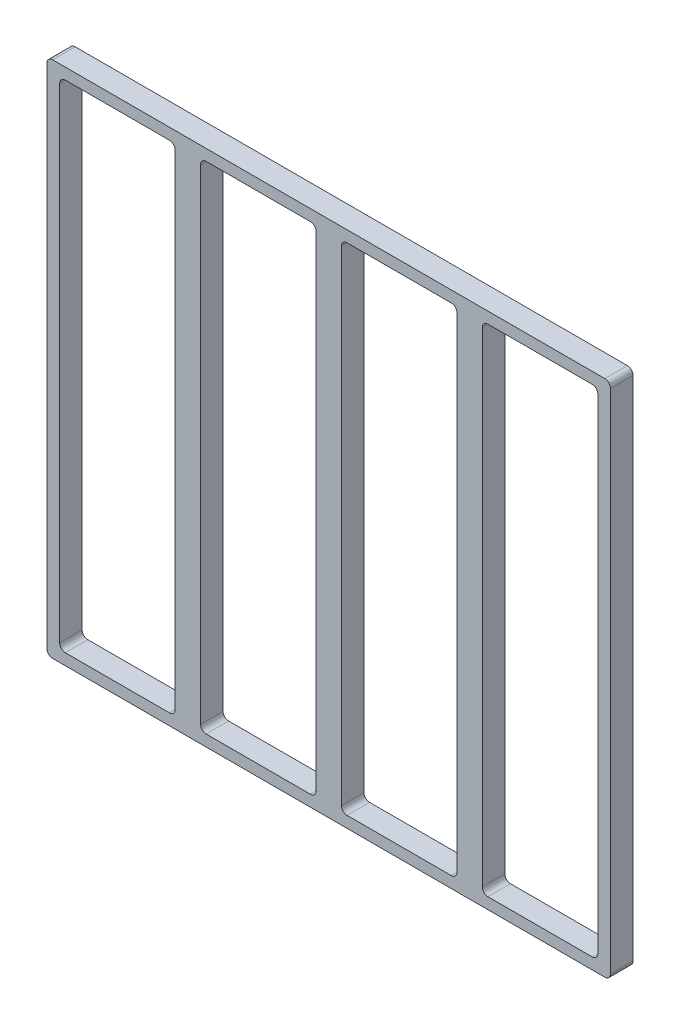
from build123d import *

# Parameters (mm, degrees)
BOSS_EXTRUDE1_DEPTH = 4


with BuildPart() as part:
    # Sketch1 → Boss-Extrude1 (new body)
    with BuildSketch(Plane.XY):
        with BuildLine():
            Line((-49, -46), (49, -46))
            ThreePointArc((49, -46), (49.707106781, -45.707106781), (50, -45))
            Line((50, -45), (50, 45))
            ThreePointArc((50, 45), (49.707106781, 45.707106781), (49, 46))
            Line((49, 46), (-49, 46))
            ThreePointArc((-49, 46), (-49.707106781, 45.707106781), (-50, 45))
            Line((-50, 45), (-50, -45))
            ThreePointArc((-50, -45), (-49.707106781, -45.707106781), (-49, -46))
        make_face()
        with BuildLine():
            Line((-46.75, 44), (-28.25, 44))
            ThreePointArc((-28.25, 44), (-27.542893219, 43.707106781), (-27.25, 43))
            Line((-27.25, 43), (-27.25, -43))
            ThreePointArc((-27.25, -43), (-27.542893219, -43.707106781), (-28.25, -44))
            Line((-28.25, -44), (-46.75, -44))
            ThreePointArc((-46.75, -44), (-47.457106781, -43.707106781), (-47.75, -43))
            Line((-47.75, -43), (-47.75, 43))
            ThreePointArc((-47.75, 43), (-47.457106781, 43.707106781), (-46.75, 44))
        make_face(mode=Mode.SUBTRACT)
        with BuildLine():
            Line((-22.75, 43), (-22.75, -43))
            ThreePointArc((-22.75, -43), (-22.457106781, -43.707106781), (-21.75, -44))
            Line((-21.75, -44), (-3.25, -44))
            ThreePointArc((-3.25, -44), (-2.542893219, -43.707106781), (-2.25, -43))
            Line((-2.25, -43), (-2.25, 43))
            ThreePointArc((-2.25, 43), (-2.542893219, 43.707106781), (-3.25, 44))
            Line((-3.25, 44), (-21.75, 44))
            ThreePointArc((-21.75, 44), (-22.457106781, 43.707106781), (-22.75, 43))
        make_face(mode=Mode.SUBTRACT)
        with BuildLine():
            Line((2.25, 43), (2.25, -43))
            ThreePointArc((2.25, -43), (2.542893219, -43.707106781), (3.25, -44))
            Line((3.25, -44), (21.75, -44))
            ThreePointArc((21.75, -44), (22.457106781, -43.707106781), (22.75, -43))
            Line((22.75, -43), (22.75, 43))
            ThreePointArc((22.75, 43), (22.457106781, 43.707106781), (21.75, 44))
            Line((21.75, 44), (3.25, 44))
            ThreePointArc((3.25, 44), (2.542893219, 43.707106781), (2.25, 43))
        make_face(mode=Mode.SUBTRACT)
        with BuildLine():
            Line((27.25, 43), (27.25, -43))
            ThreePointArc((27.25, -43), (27.542893219, -43.707106781), (28.25, -44))
            Line((28.25, -44), (46.75, -44))
            ThreePointArc((46.75, -44), (47.457106781, -43.707106781), (47.75, -43))
            Line((47.75, -43), (47.75, 43))
            ThreePointArc((47.75, 43), (47.457106781, 43.707106781), (46.75, 44))
            Line((46.75, 44), (28.25, 44))
            ThreePointArc((28.25, 44), (27.542893219, 43.707106781), (27.25, 43))
        make_face(mode=Mode.SUBTRACT)
    extrude(amount=BOSS_EXTRUDE1_DEPTH)


solid = part.part
